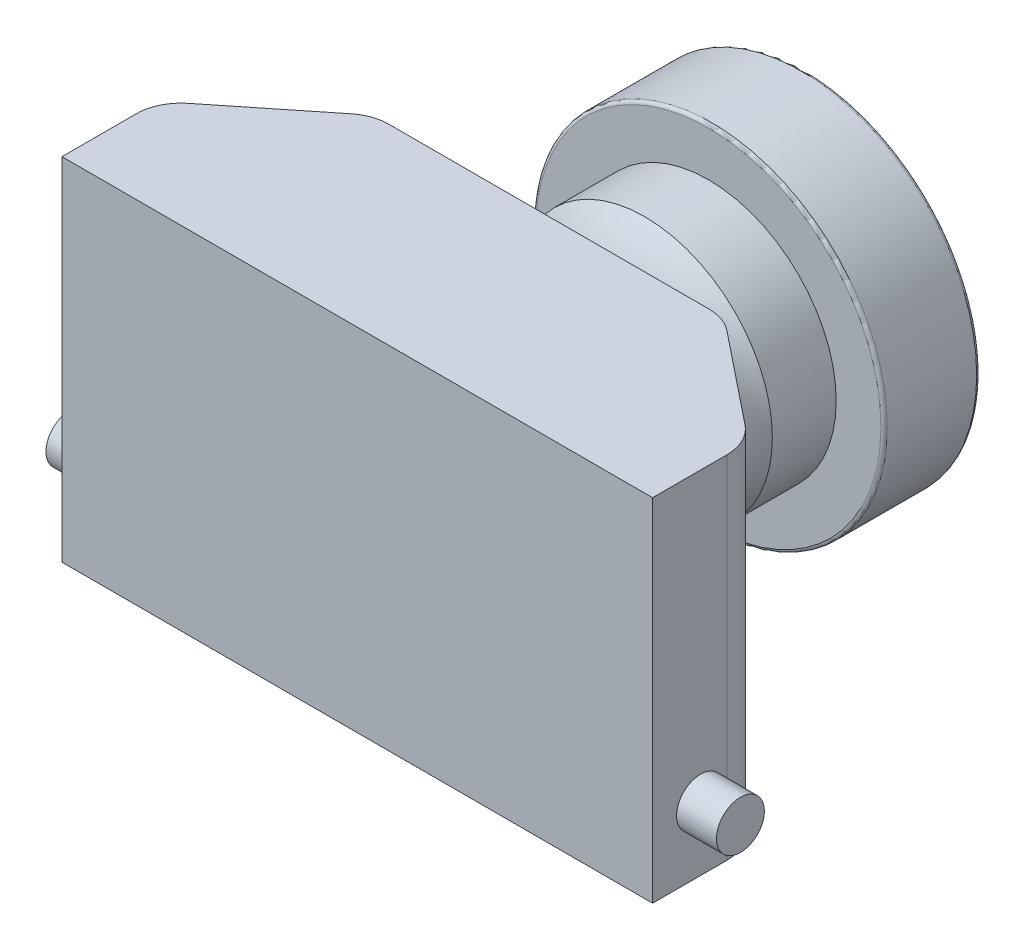
from build123d import *

# Parameters (mm, degrees)
BOSS_EXTRUDE1_DEPTH = 5.5
SKETCH5_R           = 0.75
BOSS_EXTRUDE2_DEPTH = 10.5
FILLET1_R           = 0.1
FILLET2_R           = 1.4


with BuildPart() as part:
    # Sketch1 → Boss-Extrude1 (new, symmetric)
    with BuildSketch(Plane(origin=(0, 0, 0), x_dir=(1, 0, 0), z_dir=(0, 1, 0))):
        Polygon((-9.25, 0), (9.25, 0), (9.25, 3), (5.5, 6), (-5.5, 6), (-9.25, 3), align=None)
    extrude(amount=BOSS_EXTRUDE1_DEPTH, both=True)

    # Sketch3 → Revolve2 (revolve)
    with BuildSketch(Plane(origin=(0, 0, 0), x_dir=(1, 0, 0), z_dir=(0, 1, 0))):
        with BuildLine():
            Line((4.5, 6), (0, 6))
            Line((0, 6), (0, 13.8))
            Line((0, 13.8), (5, 13.8))
            Line((5, 13.8), (5, 14))
            Line((5, 14), (5.5, 14))
            Line((5.5, 14), (5.5, 11))
            Line((5.5, 11), (4, 11))
            Line((4, 11), (4, 9))
            ThreePointArc((4, 9), (3.741329953, 7.415221659), (4.5, 6))
        make_face()
    revolve(axis=Axis((0, 0, 0), (0, 0, -1)))

    # Sketch5 → Boss-Extrude2 (add, symmetric)
    with BuildSketch(Plane(origin=(0, 0, 0), x_dir=(0, 0, -1), z_dir=(1, 0, 0))):
        with Locations(Location((1.5, -3.5, 0), (0, 0, 180))):
            Circle(SKETCH5_R)
    extrude(amount=BOSS_EXTRUDE2_DEPTH, both=True)

    # Fillet1
    fillet1_edges = [part.edges().sort_by_distance(p)[0] for p in [
        (-5.5, 0, -11),
        (-5.5, 0, -14),
        (-5, 0, -14),
    ]]
    fillet(fillet1_edges, radius=FILLET1_R)

    # Fillet2
    fillet2_edges = [part.edges().sort_by_distance(p)[0] for p in [
        (-9.25, 0, -3),
        (-5.5, 0, -6),
        (5.5, 0, -6),
        (9.25, 0, -3),
    ]]
    fillet(fillet2_edges, radius=FILLET2_R)


with BuildPart() as body_2:
    # Sketch4 → Revolve3 (revolve)
    with BuildSketch(Plane(origin=(0, 0, 0), x_dir=(1, 0, 0), z_dir=(0, 1, 0))):
        with BuildLine():
            Line((0, 13.805740022), (0, 14.805740022))
            ThreePointArc((0, 14.805740022), (2.429085009, 14.562643816), (4.75, 13.805740022))
            Line((4.75, 13.805740022), (0, 13.805740022))
        make_face()
    revolve(axis=Axis((0, 0, -13.805740022), (0, 0, -1)))


solid = Compound([part.part, body_2.part])
